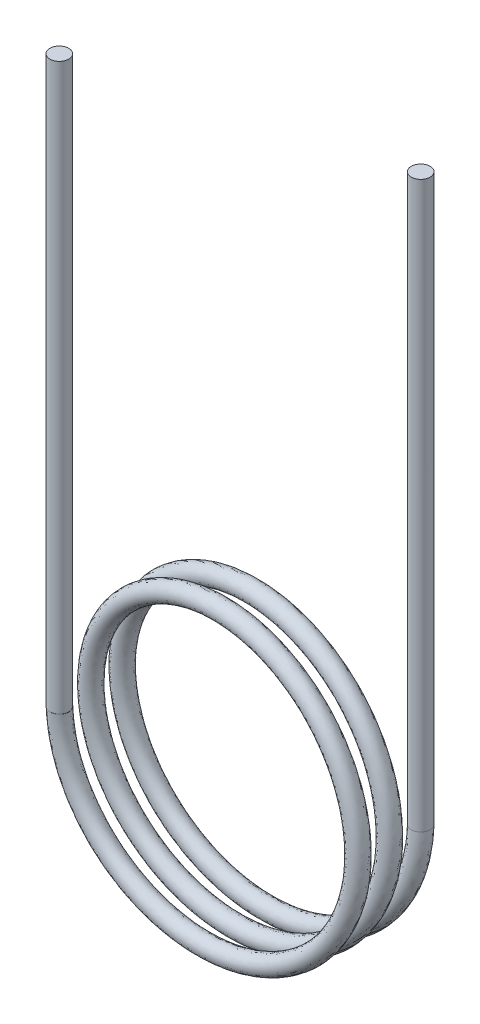
from build123d import *

# Parameters (mm, degrees)
VARREDURA1_PITCH         = 5
VARREDURA1_HEIGHT        = 12.5
VARREDURA1_RADIUS        = 22.5
ESBO_O2_R                = 1.5
ESBO_O2_2_R              = 1.5
RESSALTO_EXTRUS_O3_DEPTH = 90
ESBO_O8_R                = 1.5
RESSALTO_EXTRUS_O5_DEPTH = 90


with BuildPart() as part:
    # Varredura1: sweep along a helix
    with BuildLine() as varredura1_path:
        Helix(VARREDURA1_PITCH, VARREDURA1_HEIGHT, VARREDURA1_RADIUS, center=(0, 0, 0), direction=(0, 0, 1), lefthand=True)
    # Esboço2 → Varredura1 (sweep)
    with BuildSketch(Plane(origin=(0, 0, 0), x_dir=(1, 0, 0), z_dir=(0, 1, 0))):
        with Locations((22.5, 0)):
            Circle(ESBO_O2_R)
    sweep(path=varredura1_path.line, is_frenet=True)

    # Esboço2<2> → Ressalto-extrusão3 (add)
    with BuildSketch(Plane(origin=(0, 0, 0), x_dir=(1, 0, 0), z_dir=(0, 1, 0))):
        with Locations(Location((22.5, 0, 0), (0, 0, 270))):
            Circle(ESBO_O2_2_R)
    extrude(amount=RESSALTO_EXTRUS_O3_DEPTH)

    # Esboço8 → Ressalto-extrusão5 (add)
    with BuildSketch(Plane(origin=(0, 0, 0), x_dir=(1, 0, 0), z_dir=(0, 1, 0))):
        with Locations(Location((-22.537183834, -12.5, 0), (0, 0, 89.289822902))):
            Circle(ESBO_O8_R)
    extrude(amount=RESSALTO_EXTRUS_O5_DEPTH)


solid = part.part
